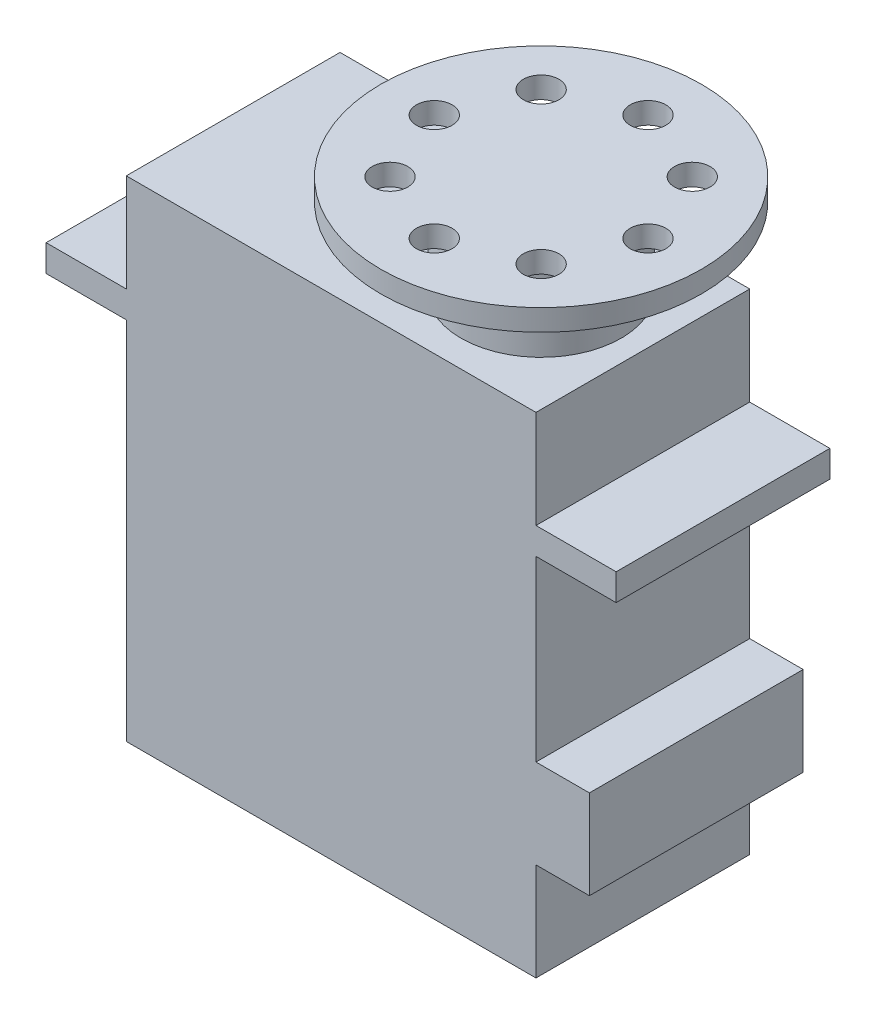
from build123d import *

# Parameters (mm, degrees)
BOSS_EXTRUDE1_DEPTH      = 6
BOSS_EXTRUDE1_DEPTH_BACK = 6
SKETCH1_W                = 23
SKETCH1_H                = 27.5
SKETCH4_R                = 4.5
BOSS_EXTRUDE2_DEPTH      = 4.4
SKETCH5_R                = 9
BOSS_EXTRUDE3_DEPTH      = 1.2
SKETCH6_R                = 1
CUT_EXTRUDE1_DEPTH       = 1.2
SKETCH7_W                = 12
SKETCH7_H                = 1.5
BOSS_EXTRUDE4_DEPTH      = 4.5
SKETCH8_W                = 12
SKETCH8_H                = 5
BOSS_EXTRUDE5_DEPTH      = 3


with BuildPart() as part:
    # Sketch1 → Boss-Extrude1 (new, two sides: drawn at the far end of the back side and taken through both)
    with BuildSketch(Plane.XY.offset(-BOSS_EXTRUDE1_DEPTH_BACK)):
        Rectangle(SKETCH1_W, SKETCH1_H)
    extrude(amount=BOSS_EXTRUDE1_DEPTH + BOSS_EXTRUDE1_DEPTH_BACK)

    # Sketch4 → Boss-Extrude2 (add)
    with BuildSketch(Plane(origin=(0, 13.75, 0), x_dir=(1, 0, 0), z_dir=(0, 1, 0))):
        with Locations(Location((5.79, 0, 0), (0, 0, 270))):
            Circle(SKETCH4_R)
    extrude(amount=BOSS_EXTRUDE2_DEPTH)

    # Sketch5 → Boss-Extrude3 (add)
    with BuildSketch(Plane(origin=(0, 18.15, 0), x_dir=(1, 0, 0), z_dir=(0, 1, 0))):
        with Locations(Location((5.79, 0, 0), (0, 0, 270))):
            Circle(SKETCH5_R)
    extrude(amount=BOSS_EXTRUDE3_DEPTH)

    # Sketch6 → Cut-Extrude1 (cut)
    with BuildSketch(Plane(origin=(0, 19.35, 0), x_dir=(1, 0, 0), z_dir=(0, 1, 0))):
        with Locations(Location((5.79, 6, 0), (0, 0, 270))):
            Circle(SKETCH6_R)
        with Locations(Location((10.032640687, 4.242640687, 0), (0, 0, 270))):
            Circle(SKETCH6_R)
        with Locations(Location((11.79, 0, 0), (0, 0, 270))):
            Circle(SKETCH6_R)
        with Locations(Location((10.032640687, -4.242640687, 0), (0, 0, 270))):
            Circle(SKETCH6_R)
        with Locations(Location((5.79, -6, 0), (0, 0, 270))):
            Circle(SKETCH6_R)
        with Locations(Location((1.547359313, -4.242640687, 0), (0, 0, 270))):
            Circle(SKETCH6_R)
        with Locations(Location((-0.21, 0, 0), (0, 0, 270))):
            Circle(SKETCH6_R)
        with Locations(Location((1.547359313, 4.242640687, 0), (0, 0, 270))):
            Circle(SKETCH6_R)
    extrude(amount=-CUT_EXTRUDE1_DEPTH, mode=Mode.SUBTRACT)

    # Sketch7 → Boss-Extrude4 (add)
    with BuildSketch(Plane.ZY.offset(11.5)):
        with Locations((0, 7.5)):
            Rectangle(SKETCH7_W, SKETCH7_H)
    boss_extrude4 = extrude(amount=BOSS_EXTRUDE4_DEPTH)

    # Mirror1: Boss-Extrude4 across plane
    add(boss_extrude4.mirror(Plane(origin=(0, 0, 0), x_dir=(0, 0, 1), z_dir=(1, 0, 0))))

    # Sketch8 → Boss-Extrude5 (add)
    with BuildSketch(Plane(origin=(11.5, 0, 0), x_dir=(0, 0, -1), z_dir=(1, 0, 0))):
        with Locations((0, -5.75)):
            Rectangle(SKETCH8_W, SKETCH8_H)
    extrude(amount=BOSS_EXTRUDE5_DEPTH)


solid = part.part
